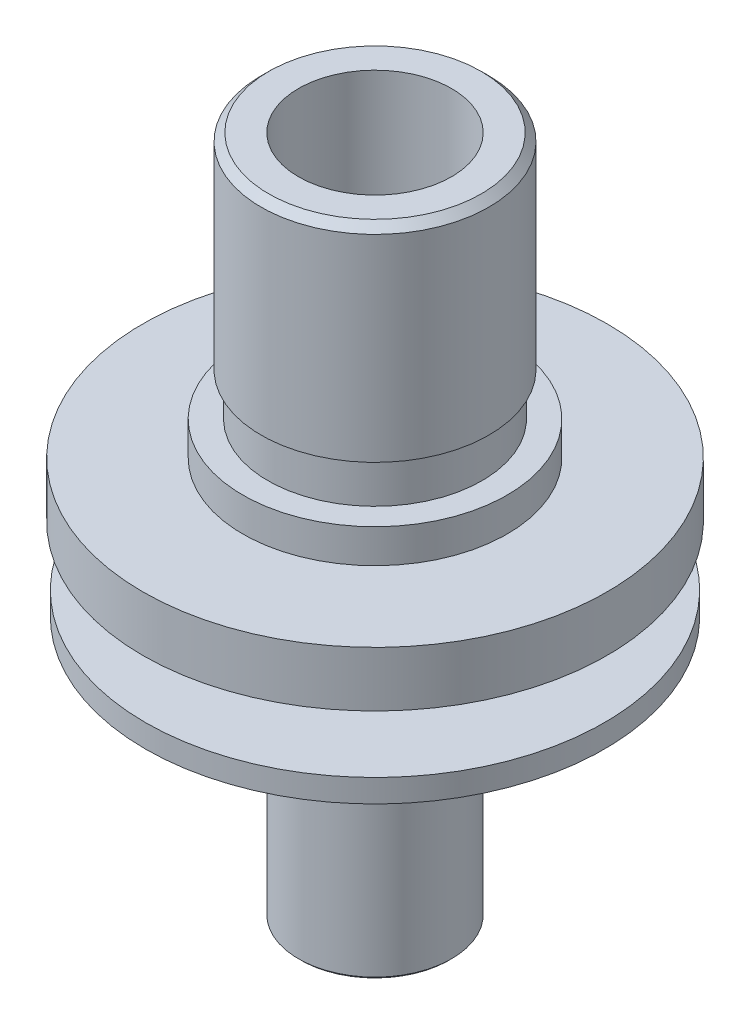
from build123d import *

# Parameters (mm, degrees)
SKETCH5_W                     = 15.875
SKETCH5_H                     = 79.375
SKETCH7_W                     = 3.4
SKETCH7_H                     = 69.85
DRIVE_PIN_HOLES_PATTERN_COUNT = 4
FLANGE_SUPPORT_CUT_REACH      = 104.834
SKETCH8_R                     = 52.5
BRAKE_HAT_HEX_DEPTH           = 4.7625
F_5_16_CLEARNCE_D             = 8.2042
SKETCH11_R                    = 3.175
TRIPOD_PINS_DEPTH             = 12.7
FILLET1_R                     = 3.175
CIRPATTERN1_COUNT             = 4
SKETCH28_R                    = 48.1625
BOSS_EXTRUDE1_DEPTH           = 11.43
SKETCH29_R                    = 47.625
BOSS_EXTRUDE2_DEPTH           = 4.7625


with BuildPart() as part:
    # Sketch1 → Bearing Shaft/Flange Support (revolve)
    with BuildSketch(Plane(origin=(0, 0, 0), x_dir=(0, 0, -1), z_dir=(1, 0, 0)), mode=Mode.PRIVATE) as bearing_shaft_flange_support_sk:
        Polygon((0, 0), (-25.0825, 0), (-25.0825, -12.319), (-47.625, -12.319), (-47.625, -17.0815), (-25.0825, -17.0815), (-15.875, -17.0815), (-15.875, -70.64248), (-15.367, -71.15048), (0, -71.15048), align=None)
    revolve(bearing_shaft_flange_support_sk.sketch.rotate(Axis((0, 0, 0), (0, 1, 0)), 180), axis=Axis((0, 0, 0), (0, 1, 0)))

    # Sketch2 → Drive Pin Support (revolve)
    with BuildSketch(Plane(origin=(0, 0, 0), x_dir=(0, 0, -1), z_dir=(1, 0, 0)), mode=Mode.PRIVATE) as drive_pin_support_sk:
        Polygon((0, 0), (-52.5, 0), (-52.5, 11.43), (-27.4096, 11.43), (-27.4096, 18.43), (-22.225, 18.43), (-22.225, 27.305), (-23.61946, 27.305), (-23.61946, 68.2625), (-22.03196, 69.85), (0, 69.85), align=None)
    revolve(drive_pin_support_sk.sketch.rotate(Axis((0, 0, 0), (0, 1, 0)), 180), axis=Axis((0, 0, 0), (0, 1, 0)))

    # Sketch5 → Center Mass Removal (revolve, cut)
    with BuildSketch(Plane(origin=(0, 0, 0), x_dir=(0, 0, -1), z_dir=(1, 0, 0)), mode=Mode.PRIVATE) as center_mass_removal_sk:
        with Locations((7.9375, 30.1625)):
            Rectangle(SKETCH5_W, SKETCH5_H)
    revolve(center_mass_removal_sk.sketch.rotate(Axis((0, 0, 0), (0, -1, 0)), 180), axis=Axis((0, 0, 0), (0, -1, 0)), mode=Mode.SUBTRACT)

    # Sketch7 → Drive Pin Holes (revolve, cut)
    with BuildSketch(Plane(origin=(0, 0, 40), x_dir=(0, 0, -1), z_dir=(1, 0, 0))):
        with Locations((1.7, 34.925)):
            Rectangle(SKETCH7_W, SKETCH7_H)
    drive_pin_holes = revolve(axis=Axis((0, -6.35, 40), (0, 1, 0)), mode=Mode.SUBTRACT)

    # Drive Pin Holes Pattern: Drive Pin Holes ×4 about axis
    drive_pin_holes_pattern_axis = Axis((0, 0, 0), (0, 1, 0))
    for i in range(1, DRIVE_PIN_HOLES_PATTERN_COUNT):
        add(drive_pin_holes.rotate(drive_pin_holes_pattern_axis, i * 360 / DRIVE_PIN_HOLES_PATTERN_COUNT), mode=Mode.SUBTRACT)

    # Sketch8 → Flange Support Cut (cut, up to next)
    with BuildSketch(Plane.XZ, mode=Mode.PRIVATE) as flange_support_cut_sk1:
        Circle(SKETCH8_R)
        with BuildLine():
            ThreePointArc((6.851776468, 44.436165629), (0, 48.1625), (-6.851776468, 44.436165629))
            ThreePointArc((-6.851776468, 44.436165629), (-9.964767607, 39.850591878), (-13.274865482, 35.405206349))
            ThreePointArc((-13.274865482, 35.405206349), (-33.675960454, 33.675960454), (-35.405206349, 13.274865482))
            ThreePointArc((-35.405206349, 13.274865482), (-39.850591878, 9.964767607), (-44.436165629, 6.851776468))
            ThreePointArc((-44.436165629, 6.851776468), (-48.1625, 0), (-44.436165629, -6.851776468))
            ThreePointArc((-44.436165629, -6.851776468), (-39.850591878, -9.964767607), (-35.405206349, -13.274865482))
            ThreePointArc((-35.405206349, -13.274865482), (-33.675960454, -33.675960454), (-13.274865482, -35.405206349))
            ThreePointArc((-13.274865482, -35.405206349), (-9.964767607, -39.850591878), (-6.851776468, -44.436165629))
            ThreePointArc((-6.851776468, -44.436165629), (0, -48.1625), (6.851776468, -44.436165629))
            ThreePointArc((6.851776468, -44.436165629), (9.964767607, -39.850591878), (13.274865482, -35.405206349))
            ThreePointArc((13.274865482, -35.405206349), (33.675960454, -33.675960454), (35.405206349, -13.274865482))
            ThreePointArc((35.405206349, -13.274865482), (39.850591878, -9.964767607), (44.436165629, -6.851776468))
            ThreePointArc((44.436165629, -6.851776468), (48.1625, 0), (44.436165629, 6.851776468))
            ThreePointArc((44.436165629, 6.851776468), (39.850591878, 9.964767607), (35.405206349, 13.274865482))
            ThreePointArc((35.405206349, 13.274865482), (33.675960454, 33.675960454), (13.274865482, 35.405206349))
            ThreePointArc((13.274865482, 35.405206349), (9.964767607, 39.850591878), (6.851776468, 44.436165629))
        make_face(mode=Mode.SUBTRACT)
    flange_support_cut_tool1 = extrude(flange_support_cut_sk1.sketch, amount=-FLANGE_SUPPORT_CUT_REACH, mode=Mode.PRIVATE) & part.part
    add(flange_support_cut_tool1.solids().sort_by_distance((-51.015076, 0, 0))[0], mode=Mode.SUBTRACT)

    # Sketch10 → Brake Hat Hex (cut)
    with BuildSketch(Plane.XZ.offset(17.0815)):
        with BuildLine():
            ThreePointArc((5.969, -46.0375), (0.002019456, -40.068500342), (-5.968998634, -46.033461088))
            Line((-5.968998634, -46.033461088), (-12.209057508, -46.033461088))
            ThreePointArc((-12.209057508, -46.033461088), (-0.007882397, -47.624999348), (12.193818875, -46.0375))
            Line((12.193818875, -46.0375), (5.969, -46.0375))
        make_face()
        with BuildLine():
            ThreePointArc((-33.772735089, -33.578906915), (-23.81932603, -41.240518092), (-12.209057508, -46.033461088))
            ThreePointArc((-12.209057508, -46.033461088), (-17.890731283, -30.975814606), (-33.772735089, -33.578906915))
        make_face()
        with BuildLine():
            ThreePointArc((-45.970675481, -12.443376586), (-41.248400489, -23.805673317), (-33.772735089, -33.578906915))
            Line((-33.772735089, -33.578906915), (-36.885144527, -28.188055635))
            ThreePointArc((-36.885144527, -28.188055635), (-34.699329459, -20.035999071), (-42.850646043, -17.847426092))
            Line((-42.850646043, -17.847426092), (-45.970675481, -12.443376586))
        make_face()
        with BuildLine():
            ThreePointArc((33.761617972, -33.590084503), (17.88047671, -30.981735086), (12.193818875, -46.0375))
            ThreePointArc((12.193818875, -46.0375), (23.805673317, -41.248400489), (33.761617972, -33.590084503))
        make_face()
        with BuildLine():
            ThreePointArc((-45.966553964, 12.458593085), (-47.624999348, 0.007882397), (-45.970675481, -12.443376586))
            ThreePointArc((-45.970675481, -12.443376586), (-35.771207993, 0.005920481), (-45.966553964, 12.458593085))
        make_face()
        with BuildLine():
            Line((36.88164741, -28.186034996), (33.761617972, -33.590084503))
            ThreePointArc((33.761617972, -33.590084503), (41.240518092, -23.81932603), (45.966553964, -12.458593085))
            Line((45.966553964, -12.458593085), (42.854144527, -17.849444365))
            ThreePointArc((42.854144527, -17.849444365), (34.701348915, -20.032501271), (36.88164741, -28.186034996))
        make_face()
        with BuildLine():
            ThreePointArc((-33.761617972, 33.590084503), (-41.240518092, 23.81932603), (-45.966553964, 12.458593085))
            Line((-45.966553964, 12.458593085), (-42.854144527, 17.849444365))
            ThreePointArc((-42.854144527, 17.849444365), (-34.701348915, 20.032501271), (-36.88164741, 28.186034996))
            Line((-36.88164741, 28.186034996), (-33.761617972, 33.590084503))
        make_face()
        with BuildLine():
            ThreePointArc((45.970675481, 12.443376586), (35.771207993, -0.005920481), (45.966553964, -12.458593085))
            ThreePointArc((45.966553964, -12.458593085), (47.624999348, -0.007882397), (45.970675481, 12.443376586))
        make_face()
        with BuildLine():
            ThreePointArc((-12.193818875, 46.0375), (-23.805673317, 41.248400489), (-33.761617972, 33.590084503))
            ThreePointArc((-33.761617972, 33.590084503), (-17.88047671, 30.981735086), (-12.193818875, 46.0375))
        make_face()
        with BuildLine():
            Line((42.850646043, 17.847426092), (45.970675481, 12.443376586))
            ThreePointArc((45.970675481, 12.443376586), (41.248400489, 23.805673317), (33.772735089, 33.578906915))
            Line((33.772735089, 33.578906915), (36.885144527, 28.188055635))
            ThreePointArc((36.885144527, 28.188055635), (34.699329459, 20.035999071), (42.850646043, 17.847426092))
        make_face()
        with BuildLine():
            ThreePointArc((12.209057508, 46.033461088), (0.007882397, 47.624999348), (-12.193818875, 46.0375))
            Line((-12.193818875, 46.0375), (-5.969, 46.0375))
            ThreePointArc((-5.969, 46.0375), (-0.002019456, 40.068500342), (5.968998634, 46.033461088))
            Line((5.968998634, 46.033461088), (12.209057508, 46.033461088))
        make_face()
        with BuildLine():
            ThreePointArc((12.209057508, 46.033461088), (17.890731283, 30.975814606), (33.772735089, 33.578906915))
            ThreePointArc((33.772735089, 33.578906915), (23.81932603, 41.240518092), (12.209057508, 46.033461088))
        make_face()
    extrude(amount=-BRAKE_HAT_HEX_DEPTH, mode=Mode.SUBTRACT)

    # 5/16 Clearnce (through all)
    with Locations(Plane(origin=(0, -71.15048, 0), x_dir=(-1, 0, 0), z_dir=(0, -1, 0))):
        with Locations((0, 0)):
            Hole(F_5_16_CLEARNCE_D / 2)

    # Sketch11 → Tripod Pins (cut)
    with BuildSketch(Plane.XZ.offset(71.15048)):
        with Locations(Location((0, 9.525, 0), (0, 0, 270))):
            Circle(SKETCH11_R)
    tripod_pins = extrude(amount=-TRIPOD_PINS_DEPTH, mode=Mode.SUBTRACT)

    # Fillet1
    fillet1_edges = [part.edges().sort_by_distance(p)[0] for p in [
        (-35.405206349, 5.715, -13.274865482),
        (-13.274865482, 5.715, -35.405206349),
        (13.274865482, 5.715, -35.405206349),
        (35.405206349, 5.715, -13.274865482),
        (35.405206349, 5.715, 13.274865482),
        (13.274865482, 5.715, 35.405206349),
        (-13.274865482, 5.715, 35.405206349),
        (-35.405206349, 5.715, 13.274865482),
    ]]
    fillet(fillet1_edges, radius=FILLET1_R)

    # CirPattern1: Tripod Pins ×4 about axis
    cirpattern1_axis = Axis((0, 0, 0), (0, 1, 0))
    for i in range(1, CIRPATTERN1_COUNT):
        add(tripod_pins.rotate(cirpattern1_axis, i * 360 / CIRPATTERN1_COUNT), mode=Mode.SUBTRACT)

    # Sketch28 → Boss-Extrude1 (add)
    with BuildSketch(Plane(origin=(0, 11.43, 0), x_dir=(1, 0, 0), z_dir=(0, 1, 0))):
        with Locations(Location((0, 0, 0), (0, 0, 270))):
            Circle(SKETCH28_R)
    extrude(amount=-BOSS_EXTRUDE1_DEPTH)

    # Sketch29 → Boss-Extrude2 (add)
    with BuildSketch(Plane(origin=(0, -12.319, 0), x_dir=(1, 0, 0), z_dir=(0, 1, 0))):
        with Locations(Location((0, 0, 0), (0, 0, 270))):
            Circle(SKETCH29_R)
    extrude(amount=-BOSS_EXTRUDE2_DEPTH)


solid = part.part
